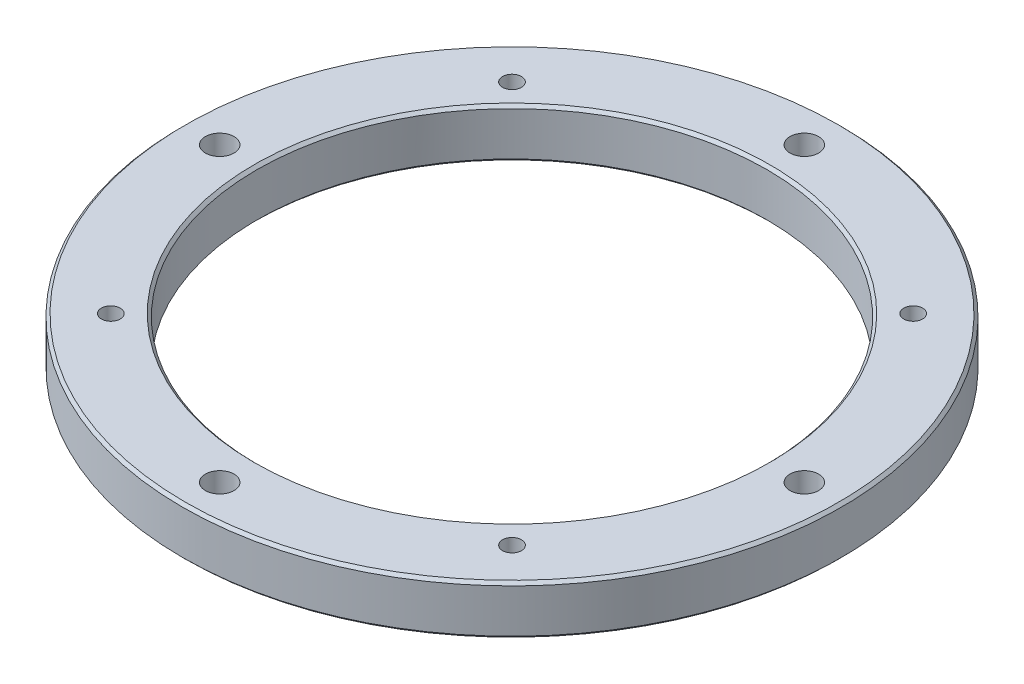
from build123d import *

# Parameters (mm, degrees)
SKETCH_1_R          = 57.5
SKETCH_1_R_2        = 44.5
EXTRUDE_1_DEPTH     = 8.6
SKETCH_2_R          = 2.5
CUT_EXTRUDE_1_DEPTH = 82.770777176
CHAMFER_1_SIZE      = 0.5
SKETCH_3_R          = 1.65
CUT_EXTRUDE_2_DEPTH = 82.770777176


with BuildPart() as part:
    # ｽｹｯﾁ1 → ﾎﾞｽ - 押し出し1 (new body)
    with BuildSketch(Plane(origin=(0, 0, 0), x_dir=(1, 0, 0), z_dir=(0, 1, 0))):
        with Locations(Location((0, 0, 0), (0, 0, 90))):
            Circle(SKETCH_1_R)
        with Locations(Location((0, 0, 0), (0, 0, 90))):
            Circle(SKETCH_1_R_2, mode=Mode.SUBTRACT)
    extrude(amount=EXTRUDE_1_DEPTH)

    # ｽｹｯﾁ2 → ｶｯﾄ - 押し出し1 (cut, through all)
    with BuildSketch(Plane(origin=(0, 8.6, 0), x_dir=(1, 0, 0), z_dir=(0, 1, 0))):
        with Locations(Location((-51, 0, 0), (0, 0, 270))):
            Circle(SKETCH_2_R)
        with Locations(Location((0, 51, 0), (0, 0, 270))):
            Circle(SKETCH_2_R)
        with Locations(Location((51, 0, 0), (0, 0, 270))):
            Circle(SKETCH_2_R)
        with Locations(Location((0, -51, 0), (0, 0, 270))):
            Circle(SKETCH_2_R)
    extrude(amount=-CUT_EXTRUDE_1_DEPTH, mode=Mode.SUBTRACT)

    # 面取り1
    chamfer_1_edges = [part.edges().sort_by_distance(p)[0] for p in [
        (0, 0, 57.5),
        (0, 8.6, 57.5),
        (0, 0, 44.5),
        (0, 8.6, 44.5),
    ]]
    chamfer(chamfer_1_edges, length=CHAMFER_1_SIZE)

    # ｽｹｯﾁ3 → ｶｯﾄ - 押し出し2 (cut, through all)
    with BuildSketch(Plane(origin=(0, 8.6, 0), x_dir=(1, 0, 0), z_dir=(0, 1, 0))):
        with Locations(Location((-35, 35, 0), (0, 0, 270))):
            Circle(SKETCH_3_R)
        with Locations(Location((-35, -35, 0), (0, 0, 270))):
            Circle(SKETCH_3_R)
        with Locations(Location((35, -35, 0), (0, 0, 270))):
            Circle(SKETCH_3_R)
        with Locations(Location((35, 35, 0), (0, 0, 270))):
            Circle(SKETCH_3_R)
    extrude(amount=-CUT_EXTRUDE_2_DEPTH, mode=Mode.SUBTRACT)


solid = part.part
